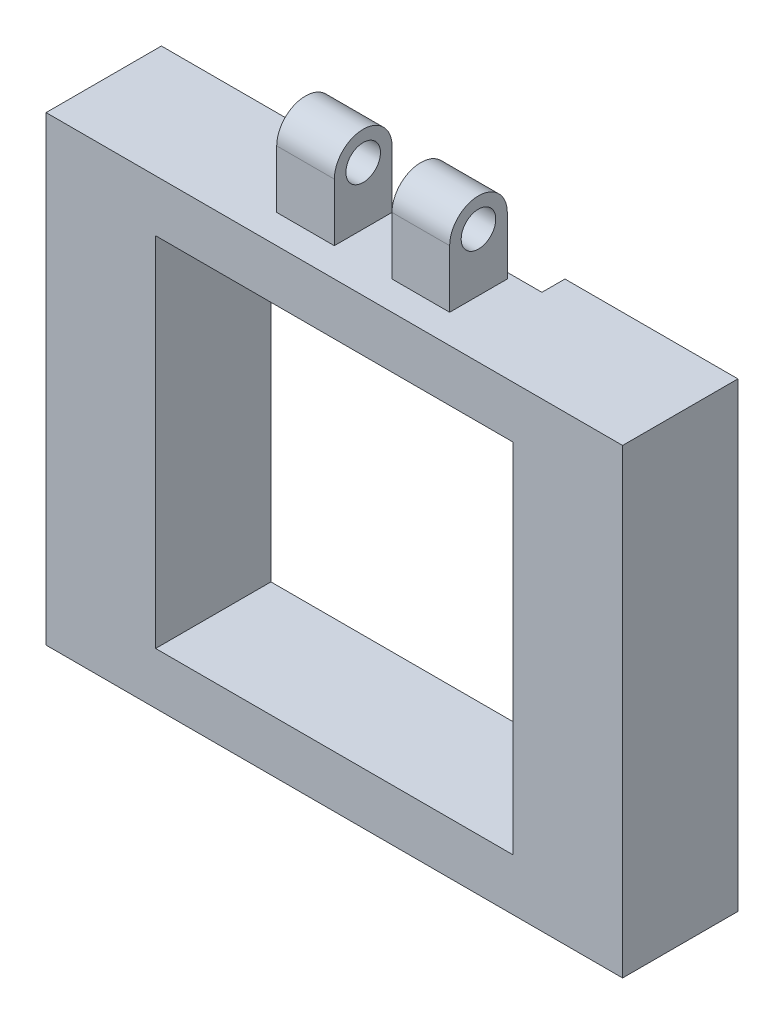
from build123d import *

# Parameters (mm, degrees)
SKETCH1_W           = 50
SKETCH1_H           = 40
BOSS_EXTRUDE1_DEPTH = 10
SKETCH5_W           = 6
SKETCH5_H           = 5
BOSS_EXTRUDE3_DEPTH = 10
SKETCH6_R           = 2
CUT_EXTRUDE1_DEPTH  = 20
SKETCH8_W           = 10
SKETCH8_H           = 40
CUT_EXTRUDE2_DEPTH  = 25
SKETCH9_W           = 10
SKETCH9_H           = 6
SKETCH9_R           = 1.930897171
BOSS_EXTRUDE4_DEPTH = 5
SKETCH10_W          = 10
SKETCH10_H          = 5
CUT_EXTRUDE3_DEPTH  = 15
SKETCH11_W          = 5
SKETCH11_H          = 5
BOSS_EXTRUDE5_DEPTH = 10
SKETCH12_R          = 1.5
CUT_EXTRUDE4_DEPTH  = 10
SKETCH13_W          = 6
SKETCH13_H          = 5
CUT_EXTRUDE5_DEPTH  = 10
SKETCH15_W          = 5
SKETCH15_H          = 5
BOSS_EXTRUDE7_DEPTH = 10
SKETCH18_W          = 5
SKETCH18_H          = 5
CUT_EXTRUDE7_DEPTH  = 10
SKETCH19_R          = 1.5
CUT_EXTRUDE8_DEPTH  = 43
CUT_EXTRUDE9_DEPTH  = 20
SKETCH21_W          = 31
SKETCH21_H          = 31
CUT_EXTRUDE10_DEPTH = 30
SKETCH22_W          = 20
SKETCH22_H          = 4.999197144
CUT_EXTRUDE11_DEPTH = 2


with BuildPart() as part:
    # Sketch1 → Boss-Extrude1 (new body)
    with BuildSketch(Plane(origin=(669.84184187, 0, 0), x_dir=(1, 0, 0), z_dir=(0, 0, 1))):
        with Locations((-671.310344828, 437.637931034)):
            Rectangle(SKETCH1_W, SKETCH1_H)
    boss_extrude1 = extrude(amount=BOSS_EXTRUDE1_DEPTH)

    # Sketch5 → Boss-Extrude3 (add)
    with BuildSketch(Plane(origin=(23.531497042, 0, 0), x_dir=(0, 0, -1), z_dir=(1, 0, 0))):
        with Locations((-5, 442.637931034)):
            Rectangle(SKETCH5_W, SKETCH5_H)
        with Locations((-5, 432.637931034)):
            Rectangle(SKETCH5_W, SKETCH5_H)
    extrude(amount=BOSS_EXTRUDE3_DEPTH)

    # Sketch6 → Cut-Extrude1 (cut)
    with BuildSketch(Plane(origin=(669.84184187, 445.137931034, 0), x_dir=(1, 0, 0), z_dir=(0, 1, 0))):
        with Locations(Location((-641.310344828, -5, 0), (0, 0, 180))):
            Circle(SKETCH6_R)
    extrude(amount=-CUT_EXTRUDE1_DEPTH, mode=Mode.SUBTRACT)

    # Sketch8 → Cut-Extrude2 (cut)
    with BuildSketch(Plane.ZY.offset(26.468502958)):
        with Locations((5, 437.637931034)):
            Rectangle(SKETCH8_W, SKETCH8_H)
    extrude(amount=-CUT_EXTRUDE2_DEPTH, mode=Mode.SUBTRACT)

    # Sketch9 → Boss-Extrude4 (add)
    with BuildSketch(Plane(origin=(0, 435.137931034, 0), x_dir=(1, 0, 0), z_dir=(0, 1, 0))):
        with Locations((28.531497042, -5)):
            Rectangle(SKETCH9_W, SKETCH9_H)
        with Locations(Location((28.531497042, -5, 0), (0, 0, 180))):
            Circle(SKETCH9_R, mode=Mode.SUBTRACT)
    extrude(amount=BOSS_EXTRUDE4_DEPTH)

    # Sketch10 → Cut-Extrude3 (cut)
    with BuildSketch(Plane.XY.offset(8)):
        with Locations((28.531497042, 432.637931034)):
            Rectangle(SKETCH10_W, SKETCH10_H)
        with Locations((28.531497042, 442.637931034)):
            Rectangle(SKETCH10_W, SKETCH10_H)
    extrude(amount=-CUT_EXTRUDE3_DEPTH, mode=Mode.SUBTRACT)

    # Mirror1: Boss-Extrude1 across plane
    add(boss_extrude1.mirror(Plane(origin=(-1.468502958, 0, 0), x_dir=(0, 0, 1), z_dir=(1, 0, 0))))

    # Sketch11 → Boss-Extrude5 (add)
    with BuildSketch(Plane(origin=(0, 457.637931034, 0), x_dir=(1, 0, 0), z_dir=(0, 1, 0))):
        with Locations((-1.468502958, -5)):
            Rectangle(SKETCH11_W, SKETCH11_H)
    extrude(amount=BOSS_EXTRUDE5_DEPTH)

    # Sketch12 → Cut-Extrude4 (cut)
    with BuildSketch(Plane(origin=(1.031497042, 0, 0), x_dir=(0, 0, -1), z_dir=(1, 0, 0))):
        with Locations((-5, 462.637931034)):
            Circle(SKETCH12_R)
    extrude(amount=-CUT_EXTRUDE4_DEPTH, mode=Mode.SUBTRACT)

    # Sketch13 → Cut-Extrude5 (cut)
    with BuildSketch(Plane(origin=(33.531497042, 0, 0), x_dir=(0, 0, -1), z_dir=(1, 0, 0))):
        with Locations((-5, 437.637931034)):
            Rectangle(SKETCH13_W, SKETCH13_H)
    extrude(amount=-CUT_EXTRUDE5_DEPTH, mode=Mode.SUBTRACT)

    # Sketch15 → Boss-Extrude7 (add)
    with BuildSketch(Plane(origin=(0, 457.637931034, 0), x_dir=(1, 0, 0), z_dir=(0, 1, 0))):
        with Locations((-6.468502958, -5)):
            Rectangle(SKETCH15_W, SKETCH15_H)
        with Locations((3.531497042, -5)):
            Rectangle(SKETCH15_W, SKETCH15_H)
    extrude(amount=BOSS_EXTRUDE7_DEPTH)

    # Sketch18 → Cut-Extrude7 (cut)
    with BuildSketch(Plane(origin=(0, 467.637931034, 0), x_dir=(1, 0, 0), z_dir=(0, 1, 0))):
        with Locations((-1.468502958, -5)):
            Rectangle(SKETCH18_W, SKETCH18_H)
    extrude(amount=-CUT_EXTRUDE7_DEPTH, mode=Mode.SUBTRACT)

    # Sketch19 → Cut-Extrude8 (cut)
    with BuildSketch(Plane.ZY.offset(8.968502958)):
        with Locations((5, 462.637931034)):
            Circle(SKETCH19_R)
    extrude(amount=-CUT_EXTRUDE8_DEPTH, mode=Mode.SUBTRACT)

    # Sketch20 → Cut-Extrude9 (cut)
    with BuildSketch(Plane(origin=(6.031497042, 0, 0), x_dir=(0, 0, -1), z_dir=(1, 0, 0))):
        with BuildLine():
            Line((-7.5, 467.637931034), (-7.5, 462.637931034))
            ThreePointArc((-7.5, 462.637931034), (-5, 465.137931034), (-2.5, 462.637931034))
            Line((-2.5, 462.637931034), (-2.5, 467.637931034))
            Line((-2.5, 467.637931034), (-7.5, 467.637931034))
        make_face()
    extrude(amount=-CUT_EXTRUDE9_DEPTH, mode=Mode.SUBTRACT)

    # Sketch21 → Cut-Extrude10 (cut)
    with BuildSketch(Plane.XY.offset(10)):
        with Locations((-1.468502958, 437.637931034)):
            Rectangle(SKETCH21_W, SKETCH21_H)
    extrude(amount=-CUT_EXTRUDE10_DEPTH, mode=Mode.SUBTRACT)

    # Sketch22 → Cut-Extrude11 (cut)
    with BuildSketch(Plane(origin=(0, 0, 0), x_dir=(-1, 0, 0), z_dir=(0, 0, -1))):
        with Locations((1.468502958, 455.138332462)):
            Rectangle(SKETCH22_W, SKETCH22_H)
    extrude(amount=-CUT_EXTRUDE11_DEPTH, mode=Mode.SUBTRACT)


solid = part.part
